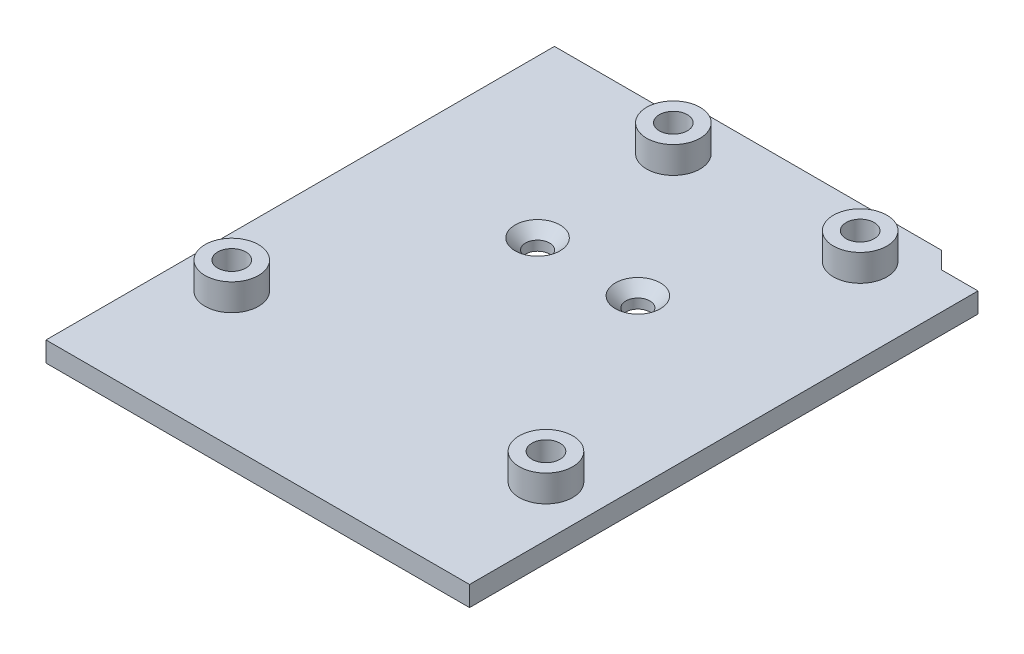
from build123d import *

# Parameters (mm, degrees)
SKETCH1_R                                            = 1.5875
BOSS_EXTRUDE1_DEPTH                                  = 3
SKETCH2_R                                            = 2.1
CUT_EXTRUDE1_DEPTH                                   = 94.949837679
BOSS_EXTRUDE2_START                                  = 4
SKETCH3_R                                            = 4
SKETCH3_R_2                                          = 2.1
BOSS_EXTRUDE2_DEPTH                                  = 4
CSK_FOR_M3_HEX_SOCKET_COUNTERSUNK_CAP_SC_D           = 3.6
CSK_FOR_M3_HEX_SOCKET_COUNTERSUNK_CAP_SC_DEPTH       = 14.44
CSK_FOR_M3_HEX_SOCKET_COUNTERSUNK_CAP_SC_CSINK_D     = 6.72
CSK_FOR_M3_HEX_SOCKET_COUNTERSUNK_CAP_SC_CSINK_ANGLE = 90
CSK_FOR_M3_HEX_SOCKET_COUNTERSUNK_CAP_SC_TIP         = 1.081549114


with BuildPart() as part:
    # Sketch1 → Boss-Extrude1 (new body)
    with BuildSketch(Plane(origin=(0, 0, 0), x_dir=(1, 0, 0), z_dir=(0, 1, 0))):
        Polygon((5, -5), (5, 71.04), (-0.468932188, 71.04), (-3.008932188, 73.58), (-39.917067812, 73.58), (-42.457067812, 71.04), (-58.34, 71.04), (-58.34, -5), align=None)
        with Locations(Location((-50.8, 15.24, 0), (0, 0, 270))):
            Circle(SKETCH1_R, mode=Mode.SUBTRACT)
        with Locations(Location((-2.54, 13.97, 0), (0, 0, 270))):
            Circle(SKETCH1_R, mode=Mode.SUBTRACT)
        with Locations(Location((-7.62, 66.04, 0), (0, 0, 270))):
            Circle(SKETCH1_R, mode=Mode.SUBTRACT)
        with Locations(Location((-35.56, 66.04, 0), (0, 0, 270))):
            Circle(SKETCH1_R, mode=Mode.SUBTRACT)
    extrude(amount=BOSS_EXTRUDE1_DEPTH)

    # Sketch2 → Cut-Extrude1 (cut, through all)
    with BuildSketch(Plane(origin=(0, 3, 0), x_dir=(1, 0, 0), z_dir=(0, 1, 0))):
        with Locations(Location((-50.8, 15.24, 0), (0, 0, 270))):
            Circle(SKETCH2_R)
        with Locations(Location((-35.56, 66.04, 0), (0, 0, 270))):
            Circle(SKETCH2_R)
        with Locations(Location((-7.62, 66.04, 0), (0, 0, 270))):
            Circle(SKETCH2_R)
        with Locations(Location((-2.54, 13.97, 0), (0, 0, 270))):
            Circle(SKETCH2_R)
    extrude(amount=-CUT_EXTRUDE1_DEPTH, mode=Mode.SUBTRACT)

    # Sketch3 → Boss-Extrude2 (add)
    # profile 1 of 4: a face of its own
    with BuildSketch(Plane(origin=(0, 3, 0), x_dir=(1, 0, 0), z_dir=(0, 1, 0)).offset(BOSS_EXTRUDE2_START)):
        with Locations(Location((-50.8, 15.24, 0), (0, 0, 270))):
            Circle(SKETCH3_R)
        with Locations(Location((-50.8, 15.24, 0), (0, 0, 270))):
            Circle(SKETCH3_R_2, mode=Mode.SUBTRACT)
    # profile 2 of 4: a face of its own
    with BuildSketch(Plane(origin=(0, 3, 0), x_dir=(1, 0, 0), z_dir=(0, 1, 0)).offset(BOSS_EXTRUDE2_START)):
        with Locations(Location((-35.56, 66.04, 0), (0, 0, 270))):
            Circle(SKETCH3_R)
        with Locations(Location((-35.56, 66.04, 0), (0, 0, 270))):
            Circle(SKETCH3_R_2, mode=Mode.SUBTRACT)
    # profile 3 of 4: a face of its own
    with BuildSketch(Plane(origin=(0, 3, 0), x_dir=(1, 0, 0), z_dir=(0, 1, 0)).offset(BOSS_EXTRUDE2_START)):
        with Locations(Location((-7.62, 66.04, 0), (0, 0, 270))):
            Circle(SKETCH3_R)
        with Locations(Location((-7.62, 66.04, 0), (0, 0, 270))):
            Circle(SKETCH3_R_2, mode=Mode.SUBTRACT)
    # profile 4 of 4: a face of its own
    with BuildSketch(Plane(origin=(0, 3, 0), x_dir=(1, 0, 0), z_dir=(0, 1, 0)).offset(BOSS_EXTRUDE2_START)):
        with Locations(Location((-2.54, 13.97, 0), (0, 0, 270))):
            Circle(SKETCH3_R)
        with Locations(Location((-2.54, 13.97, 0), (0, 0, 270))):
            Circle(SKETCH3_R_2, mode=Mode.SUBTRACT)
    extrude(amount=-BOSS_EXTRUDE2_DEPTH)

    # CSK for M3 Hex Socket Countersunk Cap Screw1
    with Locations(Plane(origin=(0, 3, 0), x_dir=(1, 0, 0), z_dir=(0, 1, 0))):
        with Locations((-34.797780841, 44.973541217), (-19.797780841, 44.973541217)):
            CounterSinkHole(CSK_FOR_M3_HEX_SOCKET_COUNTERSUNK_CAP_SC_D / 2, CSK_FOR_M3_HEX_SOCKET_COUNTERSUNK_CAP_SC_CSINK_D / 2, depth=CSK_FOR_M3_HEX_SOCKET_COUNTERSUNK_CAP_SC_DEPTH, counter_sink_angle=CSK_FOR_M3_HEX_SOCKET_COUNTERSUNK_CAP_SC_CSINK_ANGLE)
            with Locations((0, 0, -(CSK_FOR_M3_HEX_SOCKET_COUNTERSUNK_CAP_SC_DEPTH + CSK_FOR_M3_HEX_SOCKET_COUNTERSUNK_CAP_SC_TIP / 2))):  # 118° drill point
                Cone(0, CSK_FOR_M3_HEX_SOCKET_COUNTERSUNK_CAP_SC_D / 2, CSK_FOR_M3_HEX_SOCKET_COUNTERSUNK_CAP_SC_TIP, mode=Mode.SUBTRACT)


solid = part.part
